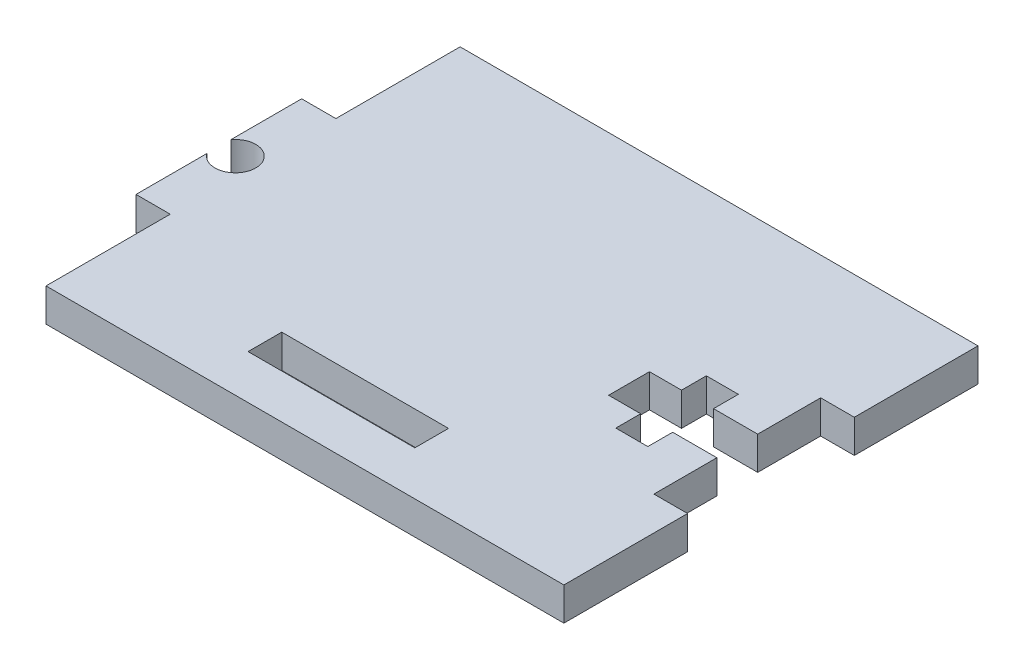
from build123d import *

# Parameters (mm, degrees)
SKETCH1_W           = 50
SKETCH1_H           = 37.5
BOSS_EXTRUDE1_DEPTH = 3
SKETCH2_W           = 15.1
SKETCH2_H           = 3.05
CUT_EXTRUDE1_DEPTH  = 32.393669744
CUT_EXTRUDE2_DEPTH  = 32.393669744
SKETCH4_W           = 3.1
SKETCH4_H           = 11.25
CUT_EXTRUDE3_DEPTH  = 32.393669744
SKETCH5_R           = 1.85
CUT_EXTRUDE4_DEPTH  = 32.393669744


with BuildPart() as part:
    # Sketch1 → Boss-Extrude1 (new body)
    with BuildSketch(Plane(origin=(0, 0, 0), x_dir=(1, 0, 0), z_dir=(0, 1, 0))):
        Rectangle(SKETCH1_W, SKETCH1_H)
    extrude(amount=BOSS_EXTRUDE1_DEPTH)

    # Sketch2 → Cut-Extrude1 (cut, through all)
    with BuildSketch(Plane(origin=(0, 3, 0), x_dir=(1, 0, 0), z_dir=(0, 1, 0))):
        with Locations((-0.05, -13.225)):
            Rectangle(SKETCH2_W, SKETCH2_H)
    extrude(amount=-CUT_EXTRUDE1_DEPTH, mode=Mode.SUBTRACT)

    # Sketch3 → Cut-Extrude2 (cut, through all)
    with BuildSketch(Plane(origin=(0, 3, 0), x_dir=(1, 0, 0), z_dir=(0, 1, 0))):
        Polygon((25, 7.55), (21.95, 7.55), (21.95, 1.85), (17.95, 1.85), (17.95, 4.1), (15.05, 4.1), (15.05, 1.85), (12.15, 1.85), (12.15, 0), (25, 0), align=None)
    cut_extrude2 = extrude(amount=-CUT_EXTRUDE2_DEPTH, mode=Mode.SUBTRACT)

    # Mirror1: Cut-Extrude2 across plane
    add(cut_extrude2.mirror(Plane.XY), mode=Mode.SUBTRACT)

    # Sketch4 → Cut-Extrude3 (cut, through all)
    with BuildSketch(Plane.XZ):
        with Locations((-23.45, -13.125)):
            Rectangle(SKETCH4_W, SKETCH4_H)
        with Locations((-23.45, 13.125)):
            Rectangle(SKETCH4_W, SKETCH4_H)
    extrude(amount=-CUT_EXTRUDE3_DEPTH, mode=Mode.SUBTRACT)

    # Sketch5 → Cut-Extrude4 (cut, through all)
    with BuildSketch(Plane.XZ):
        with Locations((-23.5, 0)):
            Circle(SKETCH5_R)
    extrude(amount=-CUT_EXTRUDE4_DEPTH, mode=Mode.SUBTRACT)


solid = part.part
